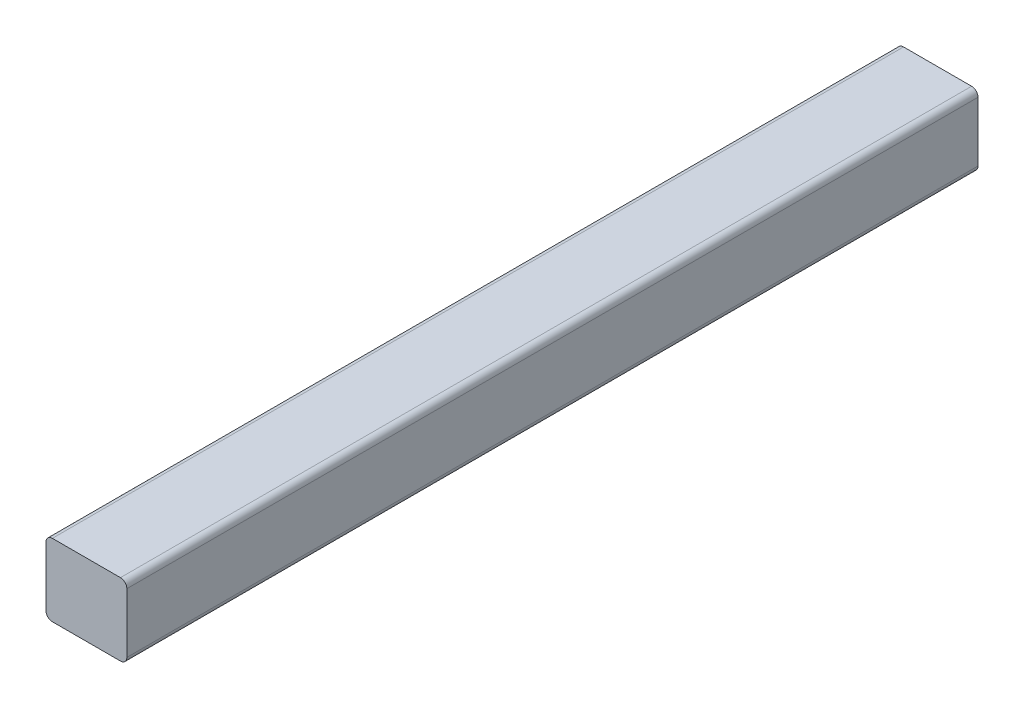
from build123d import *

# Parameters (mm, degrees)
Y_KSEKLIK_EKSTR_ZYON1_DEPTH = 100


with BuildPart() as part:
    # Model → Yükseklik-Ekstrüzyon1 (new body)
    with BuildSketch(Plane.XY):
        with BuildLine():
            ThreePointArc((-4.75, 27.989794856), (-4.530330086, 28.520124942), (-4, 28.739794856))
            Line((-4, 28.739794856), (0, 28.739794856))
            Line((0, 28.739794856), (4, 28.739794856))
            ThreePointArc((4, 28.739794856), (4.530330086, 28.520124942), (4.75, 27.989794856))
            Line((4.75, 27.989794856), (4.75, 21))
            ThreePointArc((4.75, 21), (4.530330086, 20.469669914), (4, 20.25))
            Line((4, 20.25), (0, 20.25))
            Line((0, 20.25), (-4, 20.25))
            ThreePointArc((-4, 20.25), (-4.530330086, 20.469669914), (-4.75, 21))
            Line((-4.75, 21), (-4.75, 27.989794856))
        make_face()
    extrude(amount=Y_KSEKLIK_EKSTR_ZYON1_DEPTH)


solid = part.part
